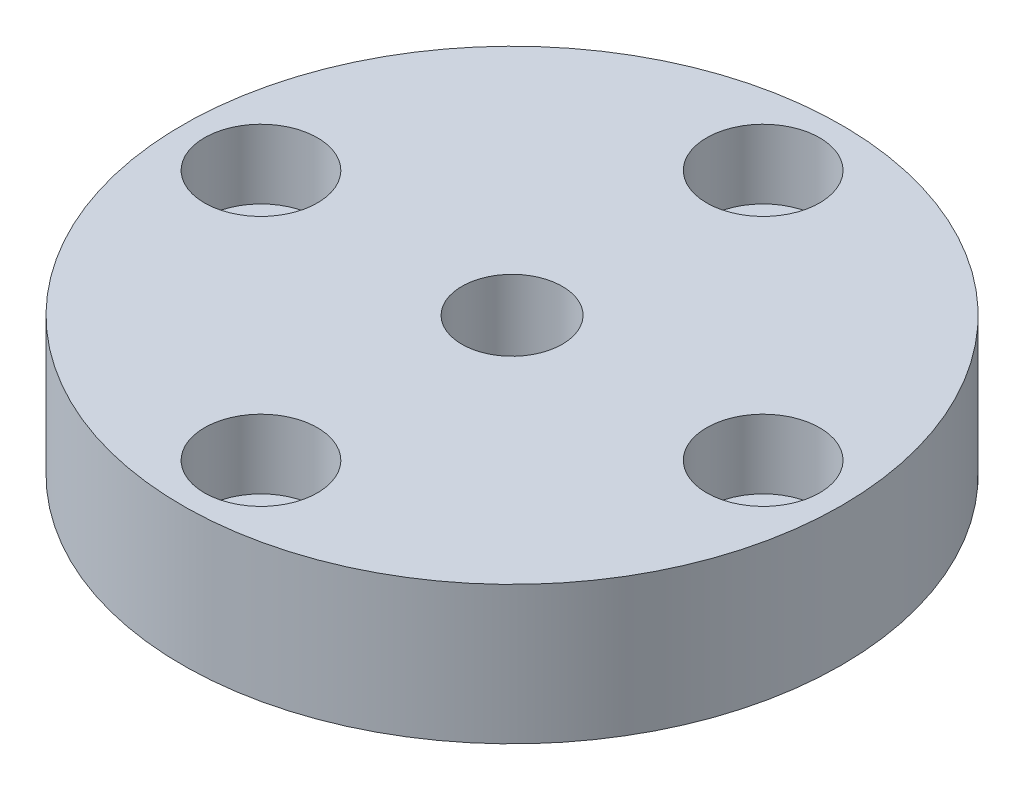
from build123d import *

# Parameters (mm, degrees)
CHAMBRAGE_POUR_VIS_T_TE_CYLINDRIQUE_D           = 11
CHAMBRAGE_POUR_VIS_T_TE_CYLINDRIQUE_CBORE_D     = 18
CHAMBRAGE_POUR_VIS_T_TE_CYLINDRIQUE_CBORE_DEPTH = 11
R_P_TITION_CIRCULAIRE1_COUNT                    = 4


with BuildPart() as part:
    # Esquisse1 → Révolution1 (revolve)
    with BuildSketch(Plane.XY):
        Polygon((8, 0), (8, 27), (52.5, 27), (52.5, 5), (25, 5), (25, 0), align=None)
    revolve(axis=Axis((0, -750.927070457, 0), (0, 1, 0)))

    # Chambrage pour vis à tête cylindrique à 6 pans creux (ou vis CHC) M101 (through all)
    with Locations(Plane(origin=(0, 27, 0), x_dir=(1, 0, 0), z_dir=(0, 1, 0))):
        with Locations((-40, 0)):
            chambrage_pour_vis_t_te_cylindrique = CounterBoreHole(CHAMBRAGE_POUR_VIS_T_TE_CYLINDRIQUE_D / 2, CHAMBRAGE_POUR_VIS_T_TE_CYLINDRIQUE_CBORE_D / 2, CHAMBRAGE_POUR_VIS_T_TE_CYLINDRIQUE_CBORE_DEPTH)

    # Répétition circulaire1: Chambrage pour vis à tête cylindrique à 6 pans creux (ou vis CHC) M101 ×4 about axis
    r_p_tition_circulaire1_axis = Axis((0, 0, 0), (0, 1, 0))
    for i in range(1, R_P_TITION_CIRCULAIRE1_COUNT):
        add(chambrage_pour_vis_t_te_cylindrique.rotate(r_p_tition_circulaire1_axis, i * 360 / R_P_TITION_CIRCULAIRE1_COUNT), mode=Mode.SUBTRACT)


solid = part.part
